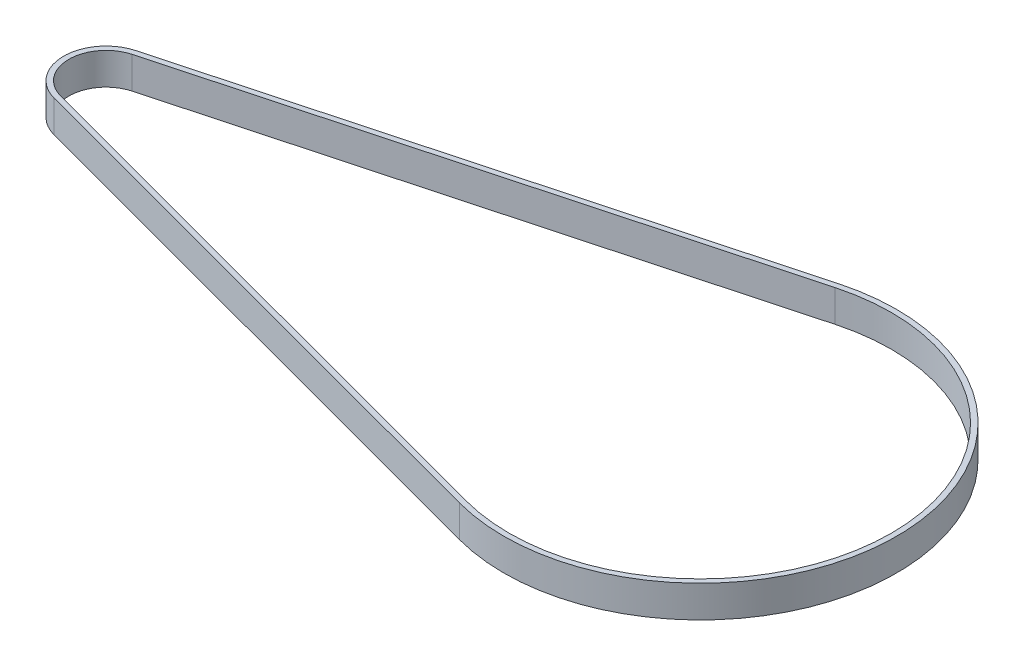
from build123d import *

# Parameters (mm, degrees)
BOSS_EXTRUDE1_DEPTH = 6


with BuildPart() as part:
    # Sketch1 → Boss-Extrude1 (new body)
    with BuildSketch(Plane(origin=(0, 0, 0), x_dir=(1, 0, 0), z_dir=(0, 1, 0))):
        with BuildLine():
            Line((-1.525146579, -7.667968265), (102.746658993, -35.534702243))
            ThreePointArc((102.746658993, -35.534702243), (149.299639585, 0.260446186), (102.650740529, 35.930501834))
            Line((102.650740529, 35.930501834), (-1.545885706, 7.783967751))
            ThreePointArc((-1.545885706, 7.783967751), (-7.45962285, 0.050048584), (-1.525146579, -7.667968265))
        make_face()
        with BuildLine():
            Line((-1.266957013, -6.70187399), (103.004848558, -34.568607967))
            ThreePointArc((103.004848558, -34.568607967), (148.299640486, 0.259104017), (102.911522486, 34.965104107))
            Line((102.911522486, 34.965104107), (-1.28510375, 6.818570024))
            ThreePointArc((-1.28510375, 6.818570024), (-6.459623751, 0.051390753), (-1.266957013, -6.70187399))
        make_face(mode=Mode.SUBTRACT)
    extrude(amount=BOSS_EXTRUDE1_DEPTH)


solid = part.part
